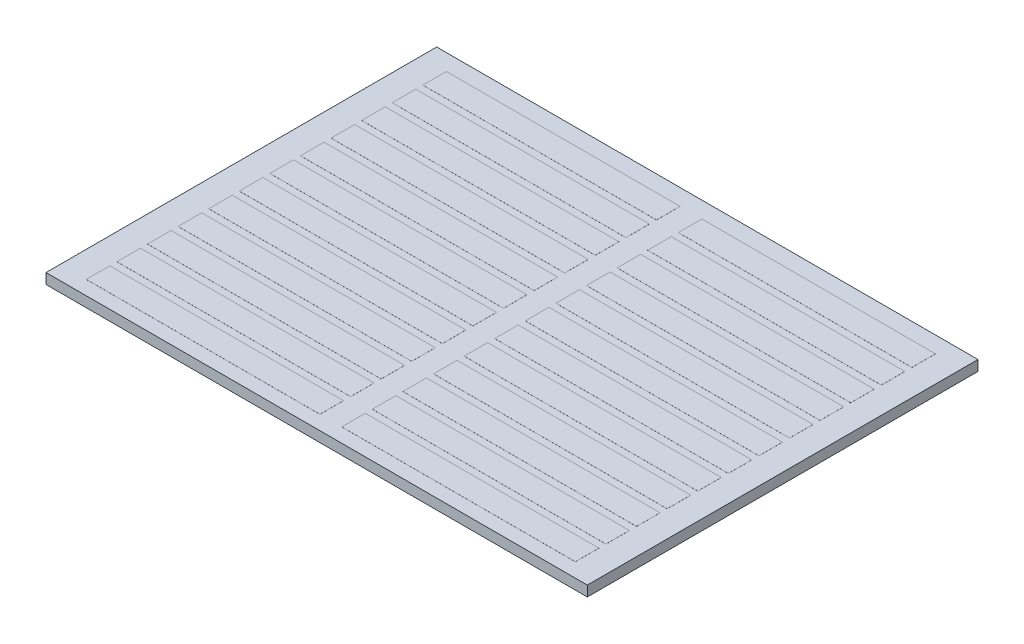
from build123d import *

# Parameters (mm, degrees)
SKETCH_1_W                = 115
SKETCH_1_H                = 83
EXTRUDE_1_DEPTH           = 2.2
SKETCH_2_W                = 49.628548445
SKETCH_2_H                = 5
EXTRUDE_2_DEPTH           = 0.01
PATTERN_LINEAR_1_COUNT    = 12
PATTERN_LINEAR_1_PITCH    = 6.5
MIRROR_1_COPY_1_SKETCH_W  = 49.628548445
MIRROR_1_COPY_1_SKETCH_H  = 5
MIRROR_1_COPY_1_DEPTH     = 0.01
MIRROR_1_COPY_2_SKETCH_W  = 49.628548445
MIRROR_1_COPY_2_SKETCH_H  = 5
MIRROR_1_COPY_2_DEPTH     = 0.01
MIRROR_1_COPY_3_SKETCH_W  = 49.628548445
MIRROR_1_COPY_3_SKETCH_H  = 5
MIRROR_1_COPY_3_DEPTH     = 0.01
MIRROR_1_COPY_4_SKETCH_W  = 49.628548445
MIRROR_1_COPY_4_SKETCH_H  = 5
MIRROR_1_COPY_4_DEPTH     = 0.01
MIRROR_1_COPY_5_SKETCH_W  = 49.628548445
MIRROR_1_COPY_5_SKETCH_H  = 5
MIRROR_1_COPY_5_DEPTH     = 0.01
MIRROR_1_COPY_6_SKETCH_W  = 49.628548445
MIRROR_1_COPY_6_SKETCH_H  = 5
MIRROR_1_COPY_6_DEPTH     = 0.01
MIRROR_1_COPY_7_SKETCH_W  = 49.628548445
MIRROR_1_COPY_7_SKETCH_H  = 5
MIRROR_1_COPY_7_DEPTH     = 0.01
MIRROR_1_COPY_8_SKETCH_W  = 49.628548445
MIRROR_1_COPY_8_SKETCH_H  = 5
MIRROR_1_COPY_8_DEPTH     = 0.01
MIRROR_1_COPY_9_SKETCH_W  = 49.628548445
MIRROR_1_COPY_9_SKETCH_H  = 5
MIRROR_1_COPY_9_DEPTH     = 0.01
MIRROR_1_COPY_10_SKETCH_W = 49.628548445
MIRROR_1_COPY_10_SKETCH_H = 5
MIRROR_1_COPY_10_DEPTH    = 0.01
MIRROR_1_COPY_11_SKETCH_W = 49.628548445
MIRROR_1_COPY_11_SKETCH_H = 5
MIRROR_1_COPY_11_DEPTH    = 0.01


with BuildPart() as part:
    # Эскиз1 → Бобышка-Вытянуть1 (new body)
    with BuildSketch(Plane(origin=(0, 0, 0), x_dir=(1, 0, 0), z_dir=(0, 1, 0))):
        Rectangle(SKETCH_1_W, SKETCH_1_H)
    extrude(amount=EXTRUDE_1_DEPTH)

    # Эскиз2 → Бобышка-Вытянуть2 (add)
    with BuildSketch(Plane(origin=(0, 2.2, 0), x_dir=(1, 0, 0), z_dir=(0, 1, 0))):
        with Locations((27.130748896, -35.988250825)):
            Rectangle(SKETCH_2_W, SKETCH_2_H)
    extrude_2 = extrude(amount=EXTRUDE_2_DEPTH)

    # Линейный массив1: Бобышка-Вытянуть2 ×12
    with Locations(*[(0, 0, -i * PATTERN_LINEAR_1_PITCH) for i in range(1, PATTERN_LINEAR_1_COUNT)]):
        add(extrude_2)

    # Зеркальное отражение1: Бобышка-Вытянуть2 across plane
    add(extrude_2.mirror(Plane(origin=(0, 0, 0), x_dir=(0, 0, 1), z_dir=(1, 0, 0))))

    # Зеркальное отражение1 copy 1 sketch → Зеркальное отражение1 copy 1 (add)
    with BuildSketch(Plane(origin=(0, 2.2, -6.5), x_dir=(-1, 0, 0), z_dir=(0, 1, 0))):
        with Locations((27.130748896, 35.988250825)):
            Rectangle(MIRROR_1_COPY_1_SKETCH_W, MIRROR_1_COPY_1_SKETCH_H)
    extrude(amount=MIRROR_1_COPY_1_DEPTH)

    # Зеркальное отражение1 copy 2 sketch → Зеркальное отражение1 copy 2 (add)
    with BuildSketch(Plane(origin=(0, 2.2, -13), x_dir=(-1, 0, 0), z_dir=(0, 1, 0))):
        with Locations((27.130748896, 35.988250825)):
            Rectangle(MIRROR_1_COPY_2_SKETCH_W, MIRROR_1_COPY_2_SKETCH_H)
    extrude(amount=MIRROR_1_COPY_2_DEPTH)

    # Зеркальное отражение1 copy 3 sketch → Зеркальное отражение1 copy 3 (add)
    with BuildSketch(Plane(origin=(0, 2.2, -19.5), x_dir=(-1, 0, 0), z_dir=(0, 1, 0))):
        with Locations((27.130748896, 35.988250825)):
            Rectangle(MIRROR_1_COPY_3_SKETCH_W, MIRROR_1_COPY_3_SKETCH_H)
    extrude(amount=MIRROR_1_COPY_3_DEPTH)

    # Зеркальное отражение1 copy 4 sketch → Зеркальное отражение1 copy 4 (add)
    with BuildSketch(Plane(origin=(0, 2.2, -26), x_dir=(-1, 0, 0), z_dir=(0, 1, 0))):
        with Locations((27.130748896, 35.988250825)):
            Rectangle(MIRROR_1_COPY_4_SKETCH_W, MIRROR_1_COPY_4_SKETCH_H)
    extrude(amount=MIRROR_1_COPY_4_DEPTH)

    # Зеркальное отражение1 copy 5 sketch → Зеркальное отражение1 copy 5 (add)
    with BuildSketch(Plane(origin=(0, 2.2, -32.5), x_dir=(-1, 0, 0), z_dir=(0, 1, 0))):
        with Locations((27.130748896, 35.988250825)):
            Rectangle(MIRROR_1_COPY_5_SKETCH_W, MIRROR_1_COPY_5_SKETCH_H)
    extrude(amount=MIRROR_1_COPY_5_DEPTH)

    # Зеркальное отражение1 copy 6 sketch → Зеркальное отражение1 copy 6 (add)
    with BuildSketch(Plane(origin=(0, 2.2, -39), x_dir=(-1, 0, 0), z_dir=(0, 1, 0))):
        with Locations((27.130748896, 35.988250825)):
            Rectangle(MIRROR_1_COPY_6_SKETCH_W, MIRROR_1_COPY_6_SKETCH_H)
    extrude(amount=MIRROR_1_COPY_6_DEPTH)

    # Зеркальное отражение1 copy 7 sketch → Зеркальное отражение1 copy 7 (add)
    with BuildSketch(Plane(origin=(0, 2.2, -45.5), x_dir=(-1, 0, 0), z_dir=(0, 1, 0))):
        with Locations((27.130748896, 35.988250825)):
            Rectangle(MIRROR_1_COPY_7_SKETCH_W, MIRROR_1_COPY_7_SKETCH_H)
    extrude(amount=MIRROR_1_COPY_7_DEPTH)

    # Зеркальное отражение1 copy 8 sketch → Зеркальное отражение1 copy 8 (add)
    with BuildSketch(Plane(origin=(0, 2.2, -52), x_dir=(-1, 0, 0), z_dir=(0, 1, 0))):
        with Locations((27.130748896, 35.988250825)):
            Rectangle(MIRROR_1_COPY_8_SKETCH_W, MIRROR_1_COPY_8_SKETCH_H)
    extrude(amount=MIRROR_1_COPY_8_DEPTH)

    # Зеркальное отражение1 copy 9 sketch → Зеркальное отражение1 copy 9 (add)
    with BuildSketch(Plane(origin=(0, 2.2, -58.5), x_dir=(-1, 0, 0), z_dir=(0, 1, 0))):
        with Locations((27.130748896, 35.988250825)):
            Rectangle(MIRROR_1_COPY_9_SKETCH_W, MIRROR_1_COPY_9_SKETCH_H)
    extrude(amount=MIRROR_1_COPY_9_DEPTH)

    # Зеркальное отражение1 copy 10 sketch → Зеркальное отражение1 copy 10 (add)
    with BuildSketch(Plane(origin=(0, 2.2, -65), x_dir=(-1, 0, 0), z_dir=(0, 1, 0))):
        with Locations((27.130748896, 35.988250825)):
            Rectangle(MIRROR_1_COPY_10_SKETCH_W, MIRROR_1_COPY_10_SKETCH_H)
    extrude(amount=MIRROR_1_COPY_10_DEPTH)

    # Зеркальное отражение1 copy 11 sketch → Зеркальное отражение1 copy 11 (add)
    with BuildSketch(Plane(origin=(0, 2.2, -71.5), x_dir=(-1, 0, 0), z_dir=(0, 1, 0))):
        with Locations((27.130748896, 35.988250825)):
            Rectangle(MIRROR_1_COPY_11_SKETCH_W, MIRROR_1_COPY_11_SKETCH_H)
    extrude(amount=MIRROR_1_COPY_11_DEPTH)


solid = part.part
